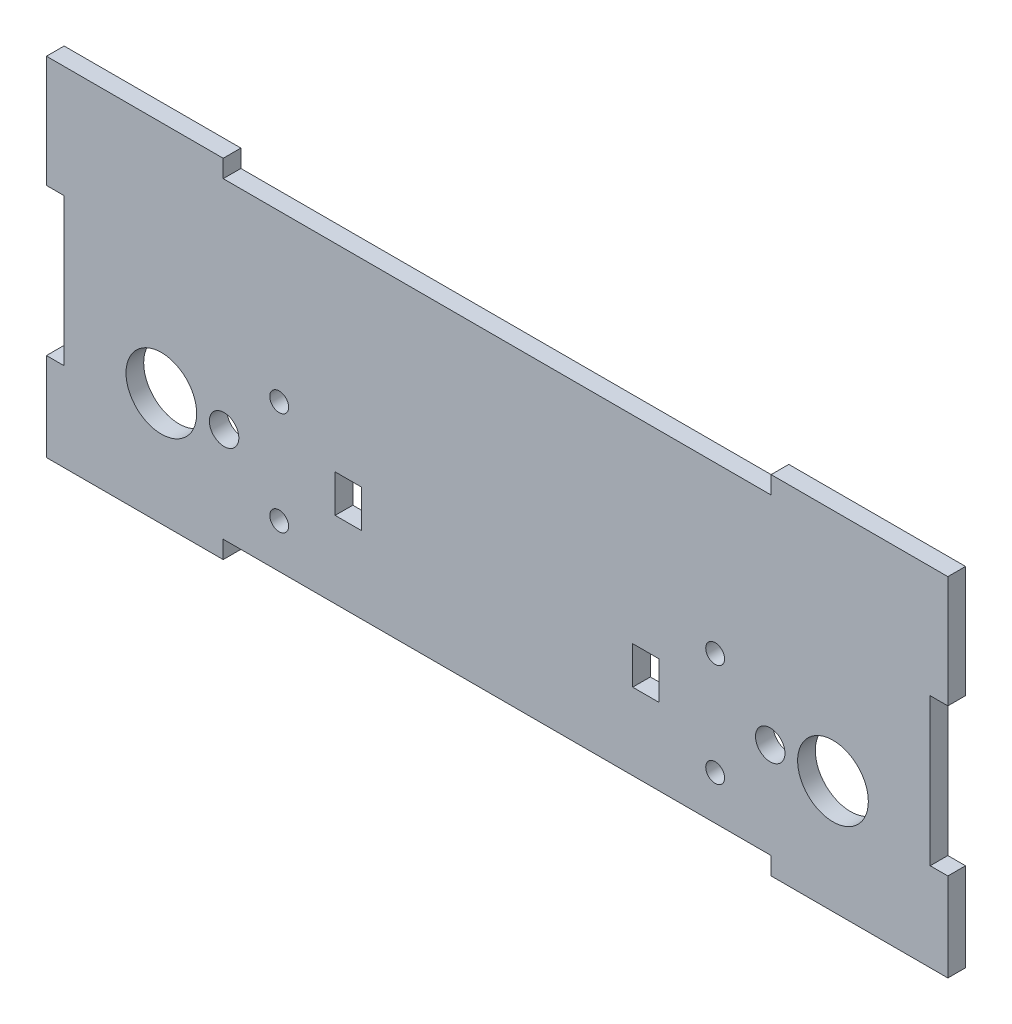
from build123d import *

# Parameters (mm, degrees)
ESBO_O1_W                = 153
ESBO_O1_H                = 59
RESSALTO_EXTRUS_O1_DEPTH = 3
ESBO_O2_W                = 93
ESBO_O2_H                = 3
CORTE_EXTRUS_O1_DEPTH    = 83.045718962
ESBO_O3_W                = 3
ESBO_O3_H                = 25
CORTE_EXTRUS_O2_DEPTH    = 83.045718962
ESBO_O4_R                = 6
CORTE_EXTRUS_O3_DEPTH    = 83.045718962
ESBO_O5_R                = 1.6
ESBO_O5_R_2              = 2.5
ESBO_O5_W                = 4.5
ESBO_O5_H                = 6.4
CORTE_EXTRUS_O4_DEPTH    = 83.045718962


with BuildPart() as part:
    # Esboço1 → Ressalto-extrusão1 (new body)
    with BuildSketch(Plane.XY):
        Rectangle(ESBO_O1_W, ESBO_O1_H)
    extrude(amount=RESSALTO_EXTRUS_O1_DEPTH)

    # Esboço2 → Corte-extrusão1 (cut, through all)
    with BuildSketch(Plane.XY.offset(3)):
        with Locations((0, 28)):
            Rectangle(ESBO_O2_W, ESBO_O2_H)
        with Locations((0, -28)):
            Rectangle(ESBO_O2_W, ESBO_O2_H)
    extrude(amount=-CORTE_EXTRUS_O1_DEPTH, mode=Mode.SUBTRACT)

    # Esboço3 → Corte-extrusão2 (cut, through all)
    with BuildSketch(Plane.XY.offset(3)):
        with Locations((-75, -2)):
            Rectangle(ESBO_O3_W, ESBO_O3_H)
        with Locations((75, -2)):
            Rectangle(ESBO_O3_W, ESBO_O3_H)
    extrude(amount=-CORTE_EXTRUS_O2_DEPTH, mode=Mode.SUBTRACT)

    # Esboço4 → Corte-extrusão3 (cut, through all)
    with BuildSketch(Plane(origin=(0, 0, 0), x_dir=(-1, 0, 0), z_dir=(0, 0, -1))):
        with Locations((57, -10.3)):
            Circle(ESBO_O4_R)
        with Locations(Location((-57, -10.3, 0), (0, 0, 180))):
            Circle(ESBO_O4_R)
    extrude(amount=-CORTE_EXTRUS_O3_DEPTH, mode=Mode.SUBTRACT)

    # Esboço5 → Corte-extrusão4 (cut, through all)
    with BuildSketch(Plane.XY):
        with Locations(Location((-37, -1.55, 0), (0, 0, 180))):
            Circle(ESBO_O5_R)
        with Locations(Location((-37, -19.05, 0), (0, 0, 180))):
            Circle(ESBO_O5_R)
        with Locations(Location((37, -19.05, 0), (0, 0, 180))):
            Circle(ESBO_O5_R)
        with Locations(Location((37, -1.55, 0), (0, 0, 180))):
            Circle(ESBO_O5_R)
        with Locations(Location((-46.35, -10.3, 0), (0, 0, 180))):
            Circle(ESBO_O5_R_2)
        with Locations(Location((46.35, -10.3, 0), (0, 0, 180))):
            Circle(ESBO_O5_R_2)
        with Locations((25.25, -10.3)):
            Rectangle(ESBO_O5_W, ESBO_O5_H)
        with Locations((-25.25, -10.3)):
            Rectangle(ESBO_O5_W, ESBO_O5_H)
    extrude(amount=CORTE_EXTRUS_O4_DEPTH, mode=Mode.SUBTRACT)


solid = part.part
